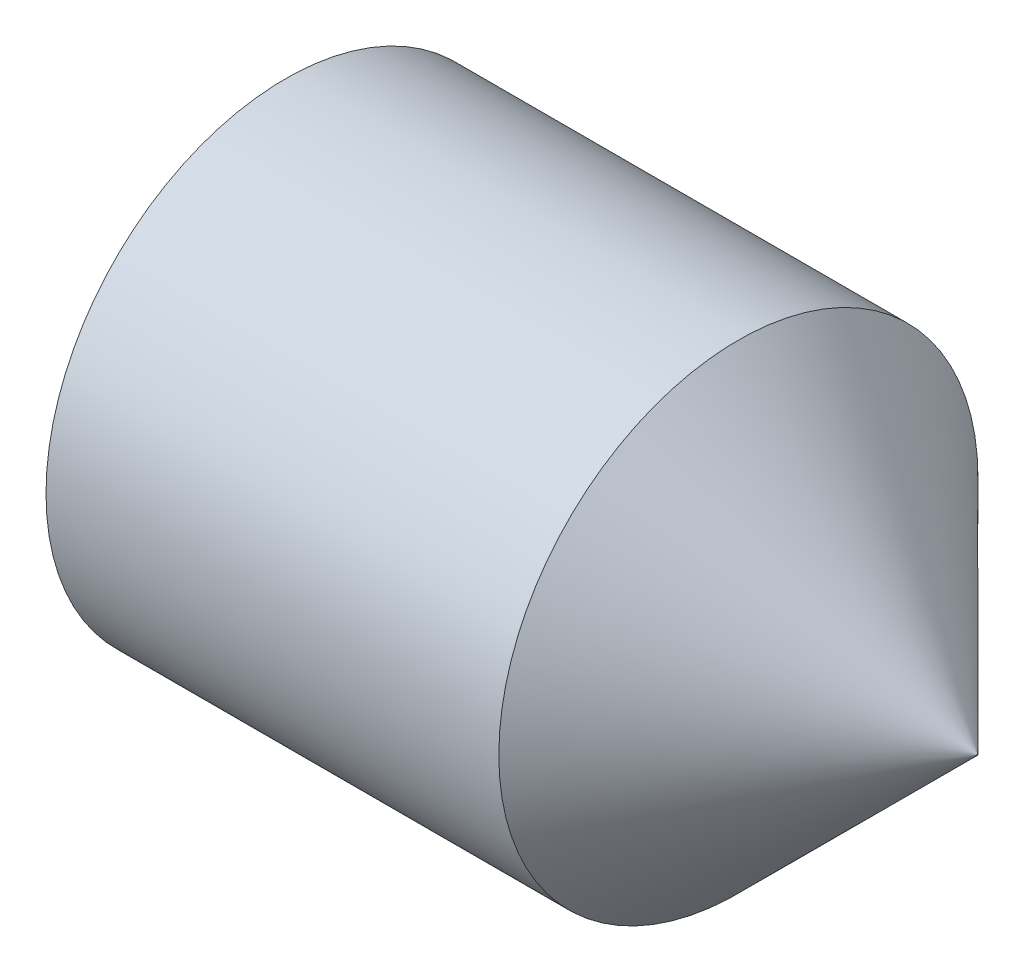
from build123d import *

# Parameters (mm, degrees)
HEX_2_DEPTH = 2.3


with BuildPart() as part:
    # BodySke → BaseBody (revolve)
    with BuildSketch(Plane.XY, mode=Mode.PRIVATE) as basebody_sk:
        Polygon((0, 0), (0, 1.61), (0.225166605, 2), (4.005, 2), (6, 0.005), (6, 0), align=None)
    revolve(basebody_sk.sketch.rotate(Axis((-12.7, 0, 0), (1, 0, 0)), 90), axis=Axis((-12.7, 0, 0), (1, 0, 0)))

    # Sketch2 → Hex 2 (cut)
    with BuildSketch(Plane.ZY):
        Polygon((0.577350269, 1), (-0.577350269, 1), (-1.154700538, 0), (-0.577350269, -1), (0.577350269, -1), (1.154700538, 0), align=None)
    extrude(amount=-HEX_2_DEPTH, mode=Mode.SUBTRACT)


solid = part.part
